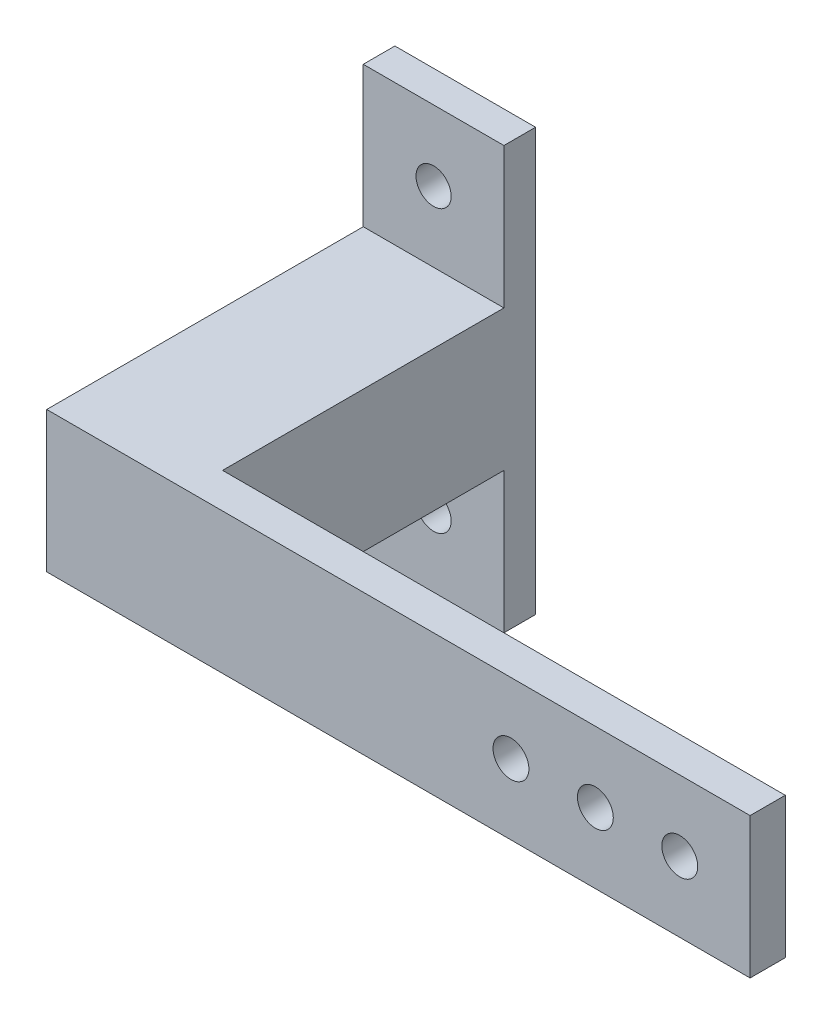
from build123d import *

# Parameters (mm, degrees)
SKETCH_1_W          = 20
SKETCH_1_H          = 60
EXTRUDE_1_DEPTH     = 4.5
SKETCH_2_W          = 20
SKETCH_2_H          = 20
EXTRUDE_2_DEPTH     = 40
SKETCH_3_W          = 100
SKETCH_3_H          = 20
EXTRUDE_3_DEPTH     = 5
SKETCH_5_R          = 2.5
CUT_EXTRUDE_2_DEPTH = 5
SKETCH_6_R          = 2.55
CUT_EXTRUDE_3_DEPTH = 10


with BuildPart() as part:
    # 草图1 → 凸台-拉伸1 (new body)
    with BuildSketch(Plane.XY):
        Rectangle(SKETCH_1_W, SKETCH_1_H)
    extrude(amount=EXTRUDE_1_DEPTH)

    # 草图2 → 凸台-拉伸2 (add)
    with BuildSketch(Plane.XY.offset(4.5)):
        Rectangle(SKETCH_2_W, SKETCH_2_H)
    extrude(amount=EXTRUDE_2_DEPTH)

    # 草图3 → 凸台-拉伸3 (add)
    with BuildSketch(Plane.XY.offset(44.5)):
        with Locations((40, 0)):
            Rectangle(SKETCH_3_W, SKETCH_3_H)
    extrude(amount=EXTRUDE_3_DEPTH)

    # 草图5 → 切除-拉伸2 (cut)
    with BuildSketch(Plane.XY.offset(4.5)):
        with Locations((0, 20)):
            Circle(SKETCH_5_R)
        with Locations((0, -20)):
            Circle(SKETCH_5_R)
    extrude(amount=-CUT_EXTRUDE_2_DEPTH, mode=Mode.SUBTRACT)

    # 草图6 → 切除-拉伸3 (cut)
    with BuildSketch(Plane.XY.offset(49.5)):
        with Locations((80, 0)):
            Circle(SKETCH_6_R)
        with Locations((68, 0)):
            Circle(SKETCH_6_R)
        with Locations((56, 0)):
            Circle(SKETCH_6_R)
    extrude(amount=-CUT_EXTRUDE_3_DEPTH, mode=Mode.SUBTRACT)


solid = part.part
